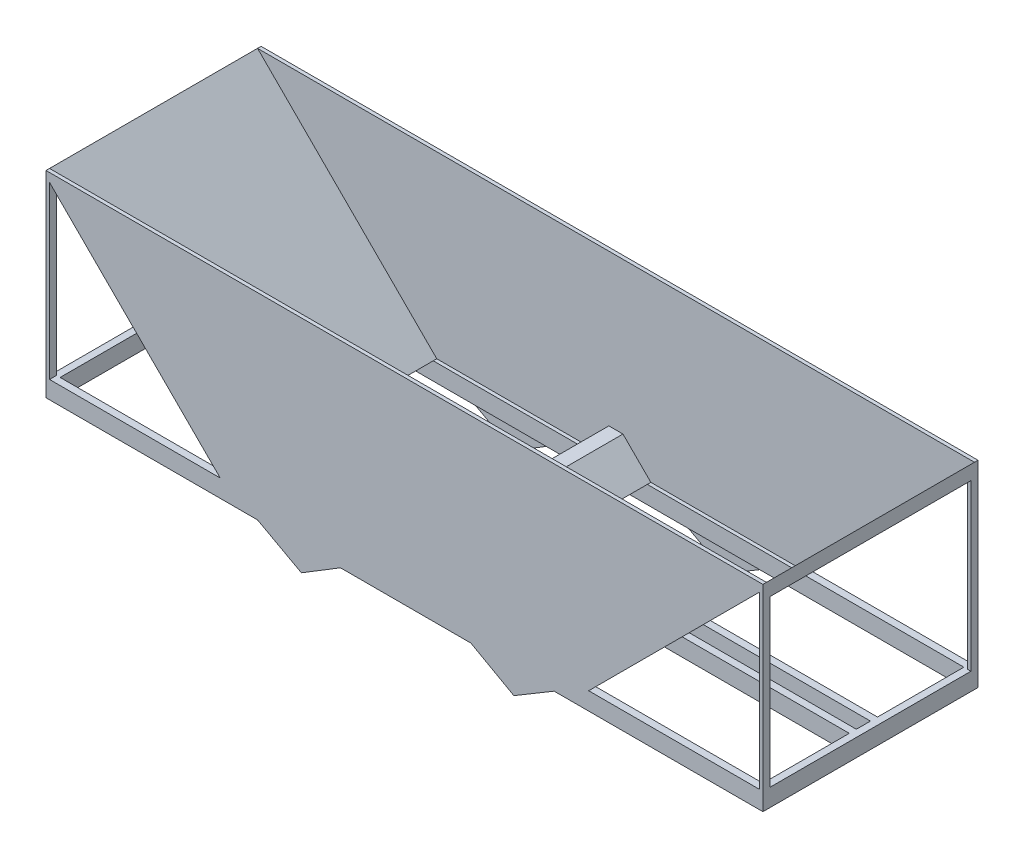
from build123d import *

# Parameters (mm, degrees)
BOSS_EXTRUDE1_DEPTH      = 10
BOSS_EXTRUDE1_DEPTH_BACK = 15
SKETCH1_W                = 1016
SKETCH1_H                = 304.8
SKETCH1_W_2              = 996
SKETCH1_H_2              = 284.8
BOSS_EXTRUDE2_DEPTH      = 10
BOSS_EXTRUDE2_DEPTH_BACK = 15
BOSS_EXTRUDE3_DEPTH      = 152.4
BOSS_EXTRUDE3_DEPTH_BACK = 152.4
SKETCH4_W                = 507.049279033
SKETCH4_H                = 40
BOSS_EXTRUDE7_DEPTH      = 5
SKETCH5_W                = 284.8
SKETCH5_H                = 234
CUT_EXTRUDE1_DEPTH       = 15
SKETCH6_W                = 284.8
SKETCH6_H                = 234
CUT_EXTRUDE2_DEPTH       = 15
BOSS_EXTRUDE8_DEPTH      = 304.8
BOSS_EXTRUDE9_DEPTH      = 5
BOSS_EXTRUDE10_DEPTH     = 5
BOSS_EXTRUDE11_DEPTH     = 5
BOSS_EXTRUDE12_DEPTH     = 5


with BuildPart() as part:
    # Sketch1 → Boss-Extrude1 (new, two sides: drawn at the far end of the back side and taken through both)
    with BuildSketch(Plane(origin=(0, 0, 0), x_dir=(1, 0, 0), z_dir=(0, 1, 0)).offset(-BOSS_EXTRUDE1_DEPTH_BACK)):
        Rectangle(SKETCH1_W, SKETCH1_H)
        Rectangle(SKETCH1_W_2, SKETCH1_H_2, mode=Mode.SUBTRACT)
    extrude(amount=BOSS_EXTRUDE1_DEPTH + BOSS_EXTRUDE1_DEPTH_BACK)

    # Sketch2 → Boss-Extrude2 (add, two sides: drawn at the far end of the back side and taken through both)
    with BuildSketch(Plane(origin=(0, 0, 0), x_dir=(1, 0, 0), z_dir=(0, 1, 0)).offset(-BOSS_EXTRUDE2_DEPTH_BACK)):
        with BuildLine():
            Line((-498, 20), (-30, 20))
            ThreePointArc((-30, 20), (-22.928932188, 22.928932188), (-20, 30))
            Line((-20, 30), (-20, 142.4))
            Line((-20, 142.4), (-10, 142.4))
            Line((-10, 142.4), (-10, 20))
            Line((-10, 20), (-10, 10))
            Line((-10, 10), (-498, 10))
            Line((-498, 10), (-498, 20))
        make_face()
        with BuildLine():
            Line((498, 20), (498, 10))
            Line((498, 10), (10, 10))
            Line((10, 10), (10, 20))
            Line((10, 20), (10, 142.4))
            Line((10, 142.4), (20, 142.4))
            Line((20, 142.4), (20, 30))
            ThreePointArc((20, 30), (22.928932188, 22.928932188), (30, 20))
            Line((30, 20), (498, 20))
        make_face()
        with BuildLine():
            Line((-498, -10), (-10, -10))
            Line((-10, -10), (-10, -20))
            Line((-10, -20), (-10, -142.4))
            Line((-10, -142.4), (-20, -142.4))
            Line((-20, -142.4), (-20, -30))
            ThreePointArc((-20, -30), (-22.928932188, -22.928932188), (-30, -20))
            Line((-30, -20), (-498, -20))
            Line((-498, -20), (-498, -10))
        make_face()
        with BuildLine():
            Line((30, -20), (498, -20))
            Line((498, -20), (498, -10))
            Line((498, -10), (10, -10))
            Line((10, -10), (10, -20))
            Line((10, -20), (10, -142.4))
            Line((10, -142.4), (20, -142.4))
            Line((20, -142.4), (20, -30))
            ThreePointArc((20, -30), (22.928932188, -22.928932188), (30, -20))
        make_face()
    extrude(amount=BOSS_EXTRUDE2_DEPTH + BOSS_EXTRUDE2_DEPTH_BACK)

    # Sketch3 → Boss-Extrude3 (add, two sides: drawn at the far end of the back side and taken through both)
    with BuildSketch(Plane.XY.offset(-BOSS_EXTRUDE3_DEPTH_BACK)):
        Polygon((-508, 10), (-508, 264), (-254, 10), (-261.071067812, 10), (-503, 251.928932188), (-503, 10), align=None)
        Polygon((261.071067812, 10), (254, 10), (508, 264), (508, 10), (503, 10), (503, 251.928932188), align=None)
    extrude(amount=BOSS_EXTRUDE3_DEPTH + BOSS_EXTRUDE3_DEPTH_BACK)

    # Sketch4 → Boss-Extrude7 (add)
    with BuildSketch(Plane(origin=(0, 10, 0), x_dir=(1, 0, 0), z_dir=(0, 1, 0))):
        with Locations((-0.42499269, 0)):
            Rectangle(SKETCH4_W, SKETCH4_H)
    extrude(amount=BOSS_EXTRUDE7_DEPTH)

    # Sketch5 → Cut-Extrude1 (cut)
    with BuildSketch(Plane(origin=(508, 0, 0), x_dir=(0, 0, -1), z_dir=(1, 0, 0))):
        with Locations((0, 127)):
            Rectangle(SKETCH5_W, SKETCH5_H)
    extrude(amount=-CUT_EXTRUDE1_DEPTH, mode=Mode.SUBTRACT)

    # Sketch6 → Cut-Extrude2 (cut)
    with BuildSketch(Plane.ZY.offset(508)):
        with Locations((0, 127)):
            Rectangle(SKETCH6_W, SKETCH6_H)
    extrude(amount=-CUT_EXTRUDE2_DEPTH, mode=Mode.SUBTRACT)

    # Sketch7 → Boss-Extrude8 (add)
    with BuildSketch(Plane(origin=(0, 0, -152.4), x_dir=(-1, 0, 0), z_dir=(0, 0, -1))):
        Polygon((-49.38581657, 10), (-9.847908285, 49.537908285), (10.152091715, 49.537908285), (49.69, 10), align=None)
    extrude(amount=-BOSS_EXTRUDE8_DEPTH)

    # Sketch8 → Boss-Extrude9 (add)
    with BuildSketch(Plane.XY.offset(152.4)):
        Polygon((-508, 264), (508, 264), (254, 10), (-254, 10), align=None)
    extrude(amount=-BOSS_EXTRUDE9_DEPTH)

    # Sketch9 → Boss-Extrude10 (add)
    with BuildSketch(Plane(origin=(0, 0, -152.4), x_dir=(-1, 0, 0), z_dir=(0, 0, -1))):
        Polygon((-508, 264), (508, 264), (254, 10), (-254, 10), align=None)
    extrude(amount=-BOSS_EXTRUDE10_DEPTH)

    # Sketch10 → Boss-Extrude11 (add)
    with BuildSketch(Plane.XY.offset(152.4)):
        Polygon((-254, 10), (-146.084980294, -48.838499263), (-49.69, 10), align=None)
        Polygon((49.38581657, 10), (155.071097682, -49.018715311), (254, 10), align=None)
    extrude(amount=-BOSS_EXTRUDE11_DEPTH)

    # Sketch11 → Boss-Extrude12 (add)
    with BuildSketch(Plane(origin=(0, 0, -152.4), x_dir=(-1, 0, 0), z_dir=(0, 0, -1))):
        Polygon((-212.094266455, -15), (-155.071097682, -49.018715311), (-94.153514645, -15), align=None)
        Polygon((90.647443469, -15), (146.084980294, -48.838499263), (208.147785439, -15), align=None)
    extrude(amount=-BOSS_EXTRUDE12_DEPTH)


solid = part.part
